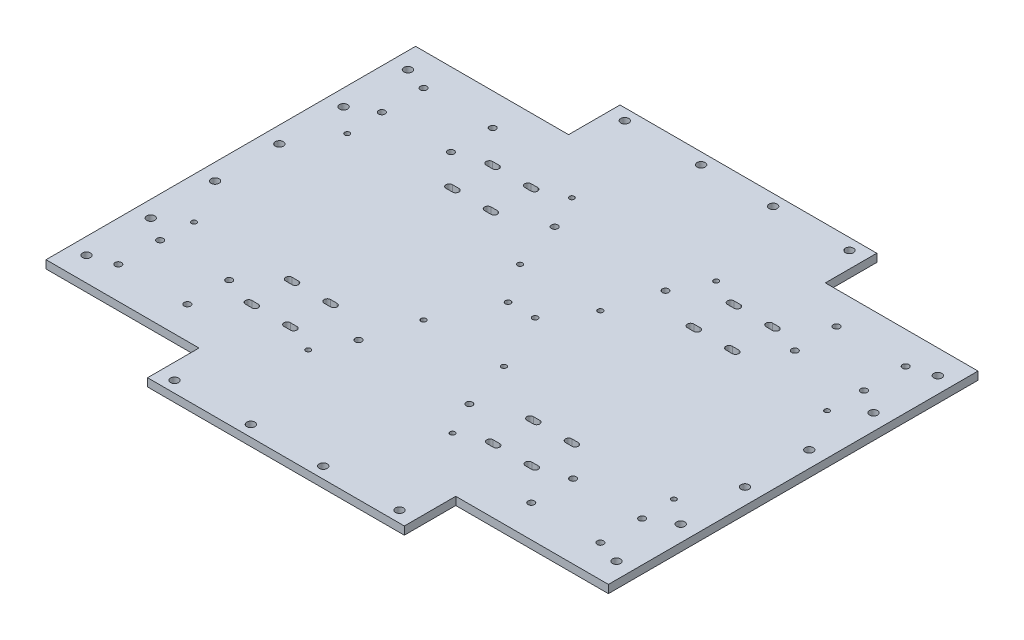
from build123d import *

# Parameters (mm, degrees)
SKETCH1_R           = 2
BOSS_EXTRUDE1_DEPTH = 5
SKETCH2_R           = 2.5
CUT_EXTRUDE2_DEPTH  = 5
CUT_EXTRUDE3_DEPTH  = 10
SKETCH4_R           = 1.7
CUT_EXTRUDE4_DEPTH  = 10
SKETCH5_R           = 1.55
CUT_EXTRUDE5_DEPTH  = 10
SKETCH6_R           = 2
CUT_EXTRUDE6_DEPTH  = 15
SKETCH7_R           = 1.6
CUT_EXTRUDE7_DEPTH  = 10


with BuildPart() as part:
    # Sketch1 → Boss-Extrude1 (new body)
    with BuildSketch(Plane(origin=(0, 0, 0), x_dir=(1, 0, 0), z_dir=(0, 1, 0))):
        Polygon((-175, 115), (-175, -115), (-79.793873465, -115), (-79.793873465, -147), (80, -147), (80, -115), (175, -115), (175, 115), (80, 115), (80, 147), (-79.793873465, 147), (-79.793873465, 115), align=None)
        with Locations((-150, 95)):
            Circle(SKETCH1_R, mode=Mode.SUBTRACT)
        with Locations((-107, 95)):
            Circle(SKETCH1_R, mode=Mode.SUBTRACT)
        with Locations((-150, 69)):
            Circle(SKETCH1_R, mode=Mode.SUBTRACT)
        with Locations((-107, 69)):
            Circle(SKETCH1_R, mode=Mode.SUBTRACT)
        with Locations((-107, -95)):
            Circle(SKETCH1_R, mode=Mode.SUBTRACT)
        with Locations((-150, -95)):
            Circle(SKETCH1_R, mode=Mode.SUBTRACT)
        with Locations((-150, -69)):
            Circle(SKETCH1_R, mode=Mode.SUBTRACT)
        with Locations((-107, -69)):
            Circle(SKETCH1_R, mode=Mode.SUBTRACT)
        with Locations((107, -69)):
            Circle(SKETCH1_R, mode=Mode.SUBTRACT)
        with Locations((150, -69)):
            Circle(SKETCH1_R, mode=Mode.SUBTRACT)
        with Locations((150, -95)):
            Circle(SKETCH1_R, mode=Mode.SUBTRACT)
        with Locations((107, -95)):
            Circle(SKETCH1_R, mode=Mode.SUBTRACT)
        with Locations((107, 69)):
            Circle(SKETCH1_R, mode=Mode.SUBTRACT)
        with Locations((150, 69)):
            Circle(SKETCH1_R, mode=Mode.SUBTRACT)
        with Locations((107, 95)):
            Circle(SKETCH1_R, mode=Mode.SUBTRACT)
        with Locations((150, 95)):
            Circle(SKETCH1_R, mode=Mode.SUBTRACT)
    extrude(amount=BOSS_EXTRUDE1_DEPTH)

    # Sketch2 → Cut-Extrude2 (cut)
    with BuildSketch(Plane(origin=(0, 5, 0), x_dir=(1, 0, 0), z_dir=(0, 1, 0))):
        with Locations((-69.793873465, 140)):
            Circle(SKETCH2_R)
        with Locations((-22.293873465, 140)):
            Circle(SKETCH2_R)
        with Locations((22.5, 140)):
            Circle(SKETCH2_R)
        with Locations((70, 140)):
            Circle(SKETCH2_R)
        with Locations((165, 100)):
            Circle(SKETCH2_R)
        with Locations((70, -140)):
            Circle(SKETCH2_R)
        with Locations((22.5, -140)):
            Circle(SKETCH2_R)
        with Locations((-22.5, -140)):
            Circle(SKETCH2_R)
        with Locations((-70, -140)):
            Circle(SKETCH2_R)
        with Locations((165, 60)):
            Circle(SKETCH2_R)
        with Locations((165, 20)):
            Circle(SKETCH2_R)
        with Locations((165, -20)):
            Circle(SKETCH2_R)
        with Locations((165, -60)):
            Circle(SKETCH2_R)
        with Locations((165, -100)):
            Circle(SKETCH2_R)
        with Locations((-164.793873465, -100)):
            Circle(SKETCH2_R)
        with Locations((-164.793873465, -60)):
            Circle(SKETCH2_R)
        with Locations((-164.793873465, -20)):
            Circle(SKETCH2_R)
        with Locations((-164.793873465, 20)):
            Circle(SKETCH2_R)
        with Locations((-164.793873465, 60)):
            Circle(SKETCH2_R)
        with Locations((-164.793873465, 100)):
            Circle(SKETCH2_R)
    extrude(amount=-CUT_EXTRUDE2_DEPTH, mode=Mode.SUBTRACT)

    # Sketch3 → Cut-Extrude3 (cut)
    with BuildSketch(Plane(origin=(0, 5, 0), x_dir=(1, 0, 0), z_dir=(0, 1, 0))):
        with BuildLine():
            Line((-85, 51.906381215), (-89, 51.906381215))
            ThreePointArc((-89, 51.906381215), (-91, 49.906381215), (-89, 47.906381215))
            Line((-89, 47.906381215), (-85, 47.906381215))
            ThreePointArc((-85, 47.906381215), (-83, 49.906381215), (-85, 51.906381215))
        make_face()
        with BuildLine():
            Line((61.206126535, 51.906381215), (65.206126535, 51.906381215))
            ThreePointArc((65.206126535, 51.906381215), (67.206126535, 49.906381215), (65.206126535, 47.906381215))
            Line((65.206126535, 47.906381215), (61.206126535, 47.906381215))
            ThreePointArc((61.206126535, 47.906381215), (59.206126535, 49.906381215), (61.206126535, 51.906381215))
        make_face()
        with BuildLine():
            Line((-61, 51.906381215), (-65, 51.906381215))
            ThreePointArc((-65, 51.906381215), (-67, 49.906381215), (-65, 47.906381215))
            Line((-65, 47.906381215), (-61, 47.906381215))
            ThreePointArc((-61, 47.906381215), (-59, 49.906381215), (-61, 51.906381215))
        make_face()
        with BuildLine():
            Line((-61, 76.906381215), (-65, 76.906381215))
            ThreePointArc((-65, 76.906381215), (-67, 74.906381215), (-65, 72.906381215))
            Line((-65, 72.906381215), (-61, 72.906381215))
            ThreePointArc((-61, 72.906381215), (-59, 74.906381215), (-61, 76.906381215))
        make_face()
        with BuildLine():
            Line((-85, 76.906381215), (-89, 76.906381215))
            ThreePointArc((-89, 76.906381215), (-91, 74.906381215), (-89, 72.906381215))
            Line((-89, 72.906381215), (-85, 72.906381215))
            ThreePointArc((-85, 72.906381215), (-83, 74.906381215), (-85, 76.906381215))
        make_face()
        with BuildLine():
            Line((85.206126535, 51.906381215), (89.206126535, 51.906381215))
            ThreePointArc((89.206126535, 51.906381215), (91.206126535, 49.906381215), (89.206126535, 47.906381215))
            Line((89.206126535, 47.906381215), (85.206126535, 47.906381215))
            ThreePointArc((85.206126535, 47.906381215), (83.206126535, 49.906381215), (85.206126535, 51.906381215))
        make_face()
        with BuildLine():
            Line((85.206126535, 76.906381215), (89.206126535, 76.906381215))
            ThreePointArc((89.206126535, 76.906381215), (91.206126535, 74.906381215), (89.206126535, 72.906381215))
            Line((89.206126535, 72.906381215), (85.206126535, 72.906381215))
            ThreePointArc((85.206126535, 72.906381215), (83.206126535, 74.906381215), (85.206126535, 76.906381215))
        make_face()
        with BuildLine():
            Line((65.206126535, 76.906381215), (61.206126535, 76.906381215))
            ThreePointArc((61.206126535, 76.906381215), (59.206126535, 74.906381215), (61.206126535, 72.906381215))
            Line((61.206126535, 72.906381215), (65.206126535, 72.906381215))
            ThreePointArc((65.206126535, 72.906381215), (67.206126535, 74.906381215), (65.206126535, 76.906381215))
        make_face()
        with BuildLine():
            Line((65.206126535, -72.906381215), (61.206126535, -72.906381215))
            ThreePointArc((61.206126535, -72.906381215), (59.206126535, -74.906381215), (61.206126535, -76.906381215))
            Line((61.206126535, -76.906381215), (65.206126535, -76.906381215))
            ThreePointArc((65.206126535, -76.906381215), (67.206126535, -74.906381215), (65.206126535, -72.906381215))
        make_face()
        with BuildLine():
            Line((89.206126535, -72.906381215), (85.206126535, -72.906381215))
            ThreePointArc((85.206126535, -72.906381215), (83.206126535, -74.906381215), (85.206126535, -76.906381215))
            Line((85.206126535, -76.906381215), (89.206126535, -76.906381215))
            ThreePointArc((89.206126535, -76.906381215), (91.206126535, -74.906381215), (89.206126535, -72.906381215))
        make_face()
        with BuildLine():
            Line((89.206126535, -47.906381215), (85.206126535, -47.906381215))
            ThreePointArc((85.206126535, -47.906381215), (83.206126535, -49.906381215), (85.206126535, -51.906381215))
            Line((85.206126535, -51.906381215), (89.206126535, -51.906381215))
            ThreePointArc((89.206126535, -51.906381215), (91.206126535, -49.906381215), (89.206126535, -47.906381215))
        make_face()
        with BuildLine():
            Line((65.206126535, -47.906381215), (61.206126535, -47.906381215))
            ThreePointArc((61.206126535, -47.906381215), (59.206126535, -49.906381215), (61.206126535, -51.906381215))
            Line((61.206126535, -51.906381215), (65.206126535, -51.906381215))
            ThreePointArc((65.206126535, -51.906381215), (67.206126535, -49.906381215), (65.206126535, -47.906381215))
        make_face()
        with BuildLine():
            Line((-85, -72.906381215), (-89, -72.906381215))
            ThreePointArc((-89, -72.906381215), (-91, -74.906381215), (-89, -76.906381215))
            Line((-89, -76.906381215), (-85, -76.906381215))
            ThreePointArc((-85, -76.906381215), (-83, -74.906381215), (-85, -72.906381215))
        make_face()
        with BuildLine():
            Line((-61, -72.906381215), (-65, -72.906381215))
            ThreePointArc((-65, -72.906381215), (-67, -74.906381215), (-65, -76.906381215))
            Line((-65, -76.906381215), (-61, -76.906381215))
            ThreePointArc((-61, -76.906381215), (-59, -74.906381215), (-61, -72.906381215))
        make_face()
        with BuildLine():
            Line((-61, -47.906381215), (-65, -47.906381215))
            ThreePointArc((-65, -47.906381215), (-67, -49.906381215), (-65, -51.906381215))
            Line((-65, -51.906381215), (-61, -51.906381215))
            ThreePointArc((-61, -51.906381215), (-59, -49.906381215), (-61, -47.906381215))
        make_face()
        with BuildLine():
            Line((-89, -47.906381215), (-85, -47.906381215))
            ThreePointArc((-85, -47.906381215), (-83, -49.906381215), (-85, -51.906381215))
            Line((-85, -51.906381215), (-89, -51.906381215))
            ThreePointArc((-89, -51.906381215), (-91, -49.906381215), (-89, -47.906381215))
        make_face()
    extrude(amount=-CUT_EXTRUDE3_DEPTH, mode=Mode.SUBTRACT)

    # Sketch4 → Cut-Extrude4 (cut)
    with BuildSketch(Plane(origin=(0, 5, 0), x_dir=(1, 0, 0), z_dir=(0, 1, 0))):
        with Locations((8.503027721, 5.894014336)):
            Circle(SKETCH4_R)
        with Locations((-8.296901185, 5.851277759)):
            Circle(SKETCH4_R)
    extrude(amount=-CUT_EXTRUDE4_DEPTH, mode=Mode.SUBTRACT)

    # Sketch5 → Cut-Extrude5 (cut)
    with BuildSketch(Plane(origin=(0, 5, 0), x_dir=(1, 0, 0), z_dir=(0, 1, 0))):
        with Locations((-149.206045272, 46.655175813)):
            Circle(SKETCH5_R)
        with Locations((-149.206045272, -48.715348759)):
            Circle(SKETCH5_R)
        with Locations((-44.81851091, -82)):
            Circle(SKETCH5_R)
        with Locations((-44.776579052, 82)):
            Circle(SKETCH5_R)
        with Locations((44.982705587, 82)):
            Circle(SKETCH5_R)
        with Locations((149.412171807, 46.655175813)):
            Circle(SKETCH5_R)
        with Locations((149.412171807, -48.715348759)):
            Circle(SKETCH5_R)
        with Locations((44.982705587, -82)):
            Circle(SKETCH5_R)
    extrude(amount=-CUT_EXTRUDE5_DEPTH, mode=Mode.SUBTRACT)

    # Sketch6 → Cut-Extrude6 (cut)
    with BuildSketch(Plane(origin=(0, 5, 0), x_dir=(1, 0, 0), z_dir=(0, 1, 0))):
        with Locations((-34.472735038, 61.03806688)):
            Circle(SKETCH6_R)
        with Locations((34.472735038, 61.03806688)):
            Circle(SKETCH6_R)
        with Locations((34.472735038, -61.03806688)):
            Circle(SKETCH6_R)
        with Locations((-34.472735038, -61.03806688)):
            Circle(SKETCH6_R)
    extrude(amount=-CUT_EXTRUDE6_DEPTH, mode=Mode.SUBTRACT)

    # Sketch7 → Cut-Extrude7 (cut)
    with BuildSketch(Plane(origin=(0, 5, 0), x_dir=(1, 0, 0), z_dir=(0, 1, 0))):
        with Locations((-25, 30)):
            Circle(SKETCH7_R)
        with Locations((25, 30)):
            Circle(SKETCH7_R)
        with Locations((25, -30)):
            Circle(SKETCH7_R)
        with Locations((-25, -30)):
            Circle(SKETCH7_R)
    extrude(amount=-CUT_EXTRUDE7_DEPTH, mode=Mode.SUBTRACT)


solid = part.part
